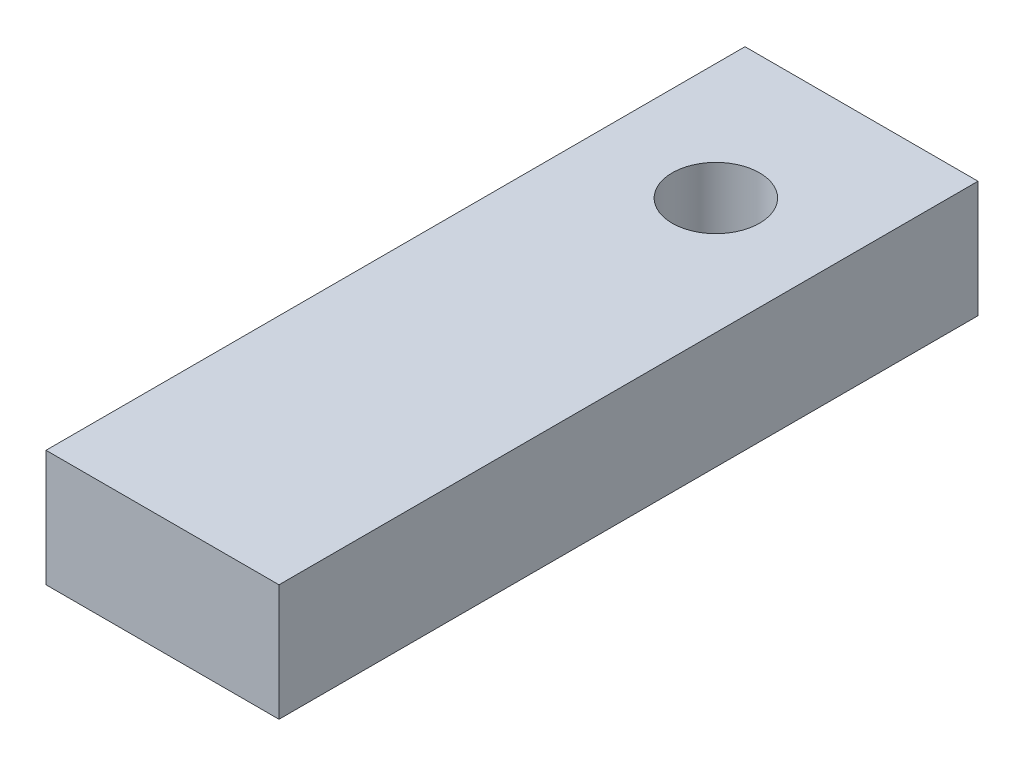
from build123d import *

# Parameters (mm, degrees)
SKETCH1_W           = 101.6
SKETCH1_H           = 50.8
BOSS_EXTRUDE1_DEPTH = 304.8
SKETCH2_R           = 19.05
CUT_EXTRUDE1_DEPTH  = 314.152231351


with BuildPart() as part:
    # Sketch1 → Boss-Extrude1 (new body)
    with BuildSketch(Plane.XY):
        Rectangle(SKETCH1_W, SKETCH1_H)
    extrude(amount=BOSS_EXTRUDE1_DEPTH)

    # Sketch2 → Cut-Extrude1 (cut, through all)
    with BuildSketch(Plane(origin=(0, 25.4, 0), x_dir=(1, 0, 0), z_dir=(0, 1, 0))):
        with Locations(Location((0, -63.5, 0), (0, 0, 270))):
            Circle(SKETCH2_R)
    extrude(amount=-CUT_EXTRUDE1_DEPTH, mode=Mode.SUBTRACT)


solid = part.part
